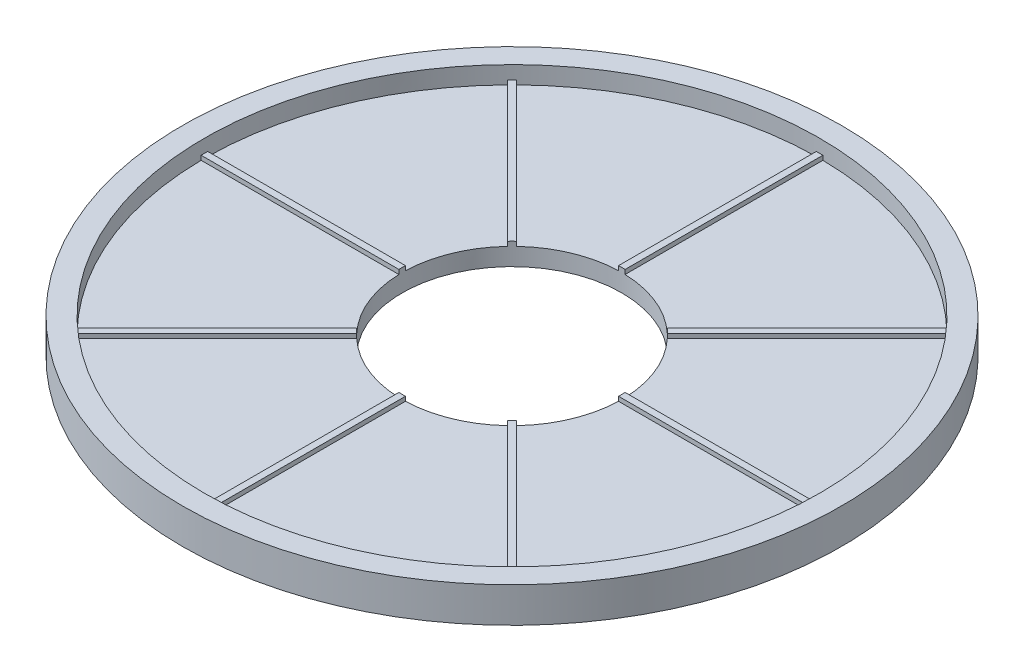
from build123d import *

# Parameters (mm, degrees)
CROQUIS1_R              = 75
SALIENTE_EXTRUIR1_DEPTH = 4
CROQUIS3_R              = 75
CROQUIS3_R_2            = 70
SALIENTE_EXTRUIR2_DEPTH = 4
SALIENTE_EXTRUIR3_DEPTH = 1
CROQUIS2_R              = 2.5
CORTAR_EXTRUIR1_DEPTH   = 2
CROQUIS4_R              = 25
CORTAR_EXTRUIR2_DEPTH   = 6


with BuildPart() as part:
    # Croquis1 → Saliente-Extruir1 (new body)
    with BuildSketch(Plane(origin=(0, 0, 0), x_dir=(1, 0, 0), z_dir=(0, 1, 0))):
        with Locations(Location((0, 0, 0), (0, 0, 270))):
            Circle(CROQUIS1_R)
    extrude(amount=SALIENTE_EXTRUIR1_DEPTH)

    # Croquis3 → Saliente-Extruir2 (add)
    with BuildSketch(Plane(origin=(0, 4, 0), x_dir=(1, 0, 0), z_dir=(0, 1, 0))):
        with Locations(Location((0, 0, 0), (0, 0, 270))):
            Circle(CROQUIS3_R)
        with Locations(Location((0, 0, 0), (0, 0, 270))):
            Circle(CROQUIS3_R_2, mode=Mode.SUBTRACT)
    extrude(amount=SALIENTE_EXTRUIR2_DEPTH)

    # Croquis7 → Saliente-Extruir3 (add)
    with BuildSketch(Plane(origin=(0, 4, 0), x_dir=(1, 0, 0), z_dir=(0, 1, 0))):
        Polygon((0.75, -1.810660172), (51.618795027, -52.679455198), (52.679455198, -51.618795027), (1.810660172, -0.75), (73.75, -0.75), (73.75, 0.75), (1.810660172, 0.75), (52.679455198, 51.618795027), (51.618795027, 52.679455198), (0.75, 1.810660172), (0.75, 73.75), (-0.75, 73.75), (-0.75, 1.810660172), (-51.618795027, 52.679455198), (-52.679455198, 51.618795027), (-1.810660172, 0.75), (-73.75, 0.75), (-73.75, -0.75), (-1.810660172, -0.75), (-52.679455198, -51.618795027), (-51.618795027, -52.679455198), (-0.75, -1.810660172), (-0.75, -73.75), (0.75, -73.75), align=None)
    extrude(amount=SALIENTE_EXTRUIR3_DEPTH)

    # Croquis2 → Cortar-Extruir1 (cut)
    with BuildSketch(Plane.XZ):
        with Locations(Location((-60, 0, 0), (0, 0, 270))):
            Circle(CROQUIS2_R)
        with Locations(Location((-42.426406871, 42.426406871, 0), (0, 0, 270))):
            Circle(CROQUIS2_R)
        with Locations(Location((0, 60, 0), (0, 0, 270))):
            Circle(CROQUIS2_R)
        with Locations(Location((42.426406871, 42.426406871, 0), (0, 0, 270))):
            Circle(CROQUIS2_R)
        with Locations(Location((60, 0, 0), (0, 0, 270))):
            Circle(CROQUIS2_R)
        with Locations(Location((42.426406871, -42.426406871, 0), (0, 0, 270))):
            Circle(CROQUIS2_R)
        with Locations(Location((0, -60, 0), (0, 0, 270))):
            Circle(CROQUIS2_R)
        with Locations(Location((-42.426406871, -42.426406871, 0), (0, 0, 270))):
            Circle(CROQUIS2_R)
    extrude(amount=-CORTAR_EXTRUIR1_DEPTH, mode=Mode.SUBTRACT)

    # Croquis4 → Cortar-Extruir2 (cut)
    with BuildSketch(Plane.XZ):
        with Locations(Location((0, 0, 0), (0, 0, 270))):
            Circle(CROQUIS4_R)
    extrude(amount=-CORTAR_EXTRUIR2_DEPTH, mode=Mode.SUBTRACT)


solid = part.part
